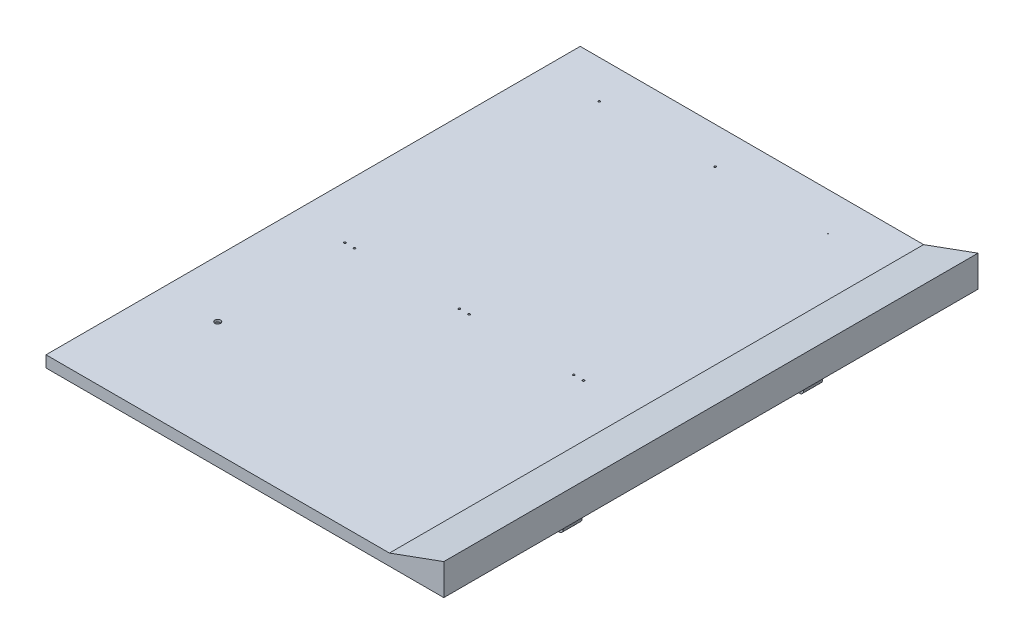
from build123d import *

# Parameters (mm, degrees)
BOSS_EXTRUDE1_DEPTH      = 1100
BOSS_EXTRUDE1_DEPTH_BACK = 300
SKETCH3_R                = 7.5
BOSS_EXTRUDE2_DEPTH      = 800
SKETCH5_R                = 7.5
CUT_EXTRUDE2_DEPTH       = 1519.191769837
SKETCH9_W                = 580
SKETCH9_H                = 60
SKETCH9_W_2              = 60
CUT_EXTRUDE5_DEPTH       = 1486.505638628
SKETCH6_W                = 25
SKETCH6_H                = 32
BOSS_EXTRUDE3_DEPTH      = 37.5
SKETCH7_W                = 16
SKETCH7_H                = 32.5
CUT_EXTRUDE3_DEPTH       = 1530.367271912
SKETCH8_W                = 16
SKETCH8_H                = 64
CUT_EXTRUDE4_DEPTH       = 24
SKETCH10_R               = 2.5908
SKETCH10_R_2             = 1.02
CUT_EXTRUDE6_DEPTH       = 20


with BuildPart() as part:
    # Sketch2 → Boss-Extrude1 (new, two sides: drawn at the far end of the back side and taken through both)
    with BuildSketch(Plane.XY.offset(-BOSS_EXTRUDE1_DEPTH_BACK)):
        Polygon((0, 0), (0, 81.865758383), (-142.5, 30), (-1042.5, 30), (-1042.5, 0), align=None)
    extrude(amount=BOSS_EXTRUDE1_DEPTH + BOSS_EXTRUDE1_DEPTH_BACK)

    # Sketch3 → Boss-Extrude2 (add)
    # profile 1 of 2: a face of its own
    with BuildSketch(Plane.XY):
        with BuildLine():
            Line((-47.5, 0), (-47.5, -50))
            ThreePointArc((-47.5, -50), (-50.428932188, -57.071067812), (-57.5, -60))
            Line((-57.5, -60), (-512.5, -60))
            ThreePointArc((-512.5, -60), (-519.571067812, -57.071067812), (-522.5, -50))
            Line((-522.5, -50), (-522.5, 0))
            Line((-522.5, 0), (-47.5, 0))
        make_face()
        with BuildLine():
            Line((-510, -42.5), (-60, -42.5))
            ThreePointArc((-60, -42.5), (-52.5, -50), (-60, -57.5))
            Line((-60, -57.5), (-510, -57.5))
            ThreePointArc((-510, -57.5), (-517.5, -50), (-510, -42.5))
        make_face(mode=Mode.SUBTRACT)
    # profile 2 of 2: a face of its own
    with BuildSketch(Plane.XY):
        with BuildLine():
            Line((-1022.5, 0), (-1022.5, -50))
            ThreePointArc((-1022.5, -50), (-1019.571067812, -57.071067812), (-1012.5, -60))
            Line((-1012.5, -60), (-1007.5, -60))
            ThreePointArc((-1007.5, -60), (-1000.428932188, -57.071067812), (-997.5, -50))
            Line((-997.5, -50), (-997.5, 0))
            Line((-997.5, 0), (-1022.5, 0))
        make_face()
        with Locations((-1010, -50)):
            Circle(SKETCH3_R, mode=Mode.SUBTRACT)
    extrude(amount=BOSS_EXTRUDE2_DEPTH)

    # Sketch5 → Cut-Extrude2 (cut, through all)
    with BuildSketch(Plane(origin=(0, 30, 0), x_dir=(1, 0, 0), z_dir=(0, 1, 0))):
        with Locations(Location((-892.5, -800, 0), (0, 0, 180))):
            Circle(SKETCH5_R)
    extrude(amount=-CUT_EXTRUDE2_DEPTH, mode=Mode.SUBTRACT)

    # Sketch9 → Cut-Extrude5 (cut, through all)
    with BuildSketch(Plane(origin=(-47.5, 0, 0), x_dir=(0, 0, -1), z_dir=(1, 0, 0))):
        with Locations((-400, -30)):
            Rectangle(SKETCH9_W, SKETCH9_H)
        Polygon((-740, -50), (-740, -60), (-800, -60), (-800, -50), (-800, 0), (-740, 0), align=None)
        with Locations((-30, -30)):
            Rectangle(SKETCH9_W_2, SKETCH9_H)
    extrude(amount=-CUT_EXTRUDE5_DEPTH, mode=Mode.SUBTRACT)

    # Sketch6 → Boss-Extrude3 (add)
    with BuildSketch(Plane.XZ):
        with Locations((-892.5, 800)):
            Rectangle(SKETCH6_W, SKETCH6_H)
    extrude(amount=BOSS_EXTRUDE3_DEPTH)

    # Sketch7 → Cut-Extrude3 (cut, through all)
    with BuildSketch(Plane.XY.offset(816)):
        with Locations((-892.5, -16.25)):
            Rectangle(SKETCH7_W, SKETCH7_H)
    extrude(amount=-CUT_EXTRUDE3_DEPTH, mode=Mode.SUBTRACT)

    # Sketch8 → Cut-Extrude4 (cut)
    with BuildSketch(Plane.XZ):
        with Locations((-892.5, 800)):
            Rectangle(SKETCH8_W, SKETCH8_H)
    extrude(amount=-CUT_EXTRUDE4_DEPTH, mode=Mode.SUBTRACT)

    # Sketch10 → Cut-Extrude6 (cut)
    with BuildSketch(Plane(origin=(0, 30, 0), x_dir=(1, 0, 0), z_dir=(0, 1, 0))):
        with Locations(Location((-892.5, 200, 0), (0, 0, 180))):
            Circle(SKETCH10_R)
        with Locations(Location((-592.5, 203.742997566, 0), (0, 0, 180))):
            Circle(SKETCH10_R)
        with Locations(Location((-292.5, 200, 0), (0, 0, 180))):
            Circle(SKETCH10_R_2)
        with Locations(Location((-905.2, -454.05, 0), (0, 0, 180))):
            Circle(SKETCH10_R)
        with Locations(Location((-879.8, -454.05, 0), (0, 0, 180))):
            Circle(SKETCH10_R)
        with Locations(Location((-605.2, -454.05, 0), (0, 0, 180))):
            Circle(SKETCH10_R)
        with Locations(Location((-579.8, -454.05, 0), (0, 0, 180))):
            Circle(SKETCH10_R)
        with Locations(Location((-305.2, -454.05, 0), (0, 0, 180))):
            Circle(SKETCH10_R)
        with Locations(Location((-279.8, -454.05, 0), (0, 0, 180))):
            Circle(SKETCH10_R)
    extrude(amount=-CUT_EXTRUDE6_DEPTH, mode=Mode.SUBTRACT)


solid = part.part
